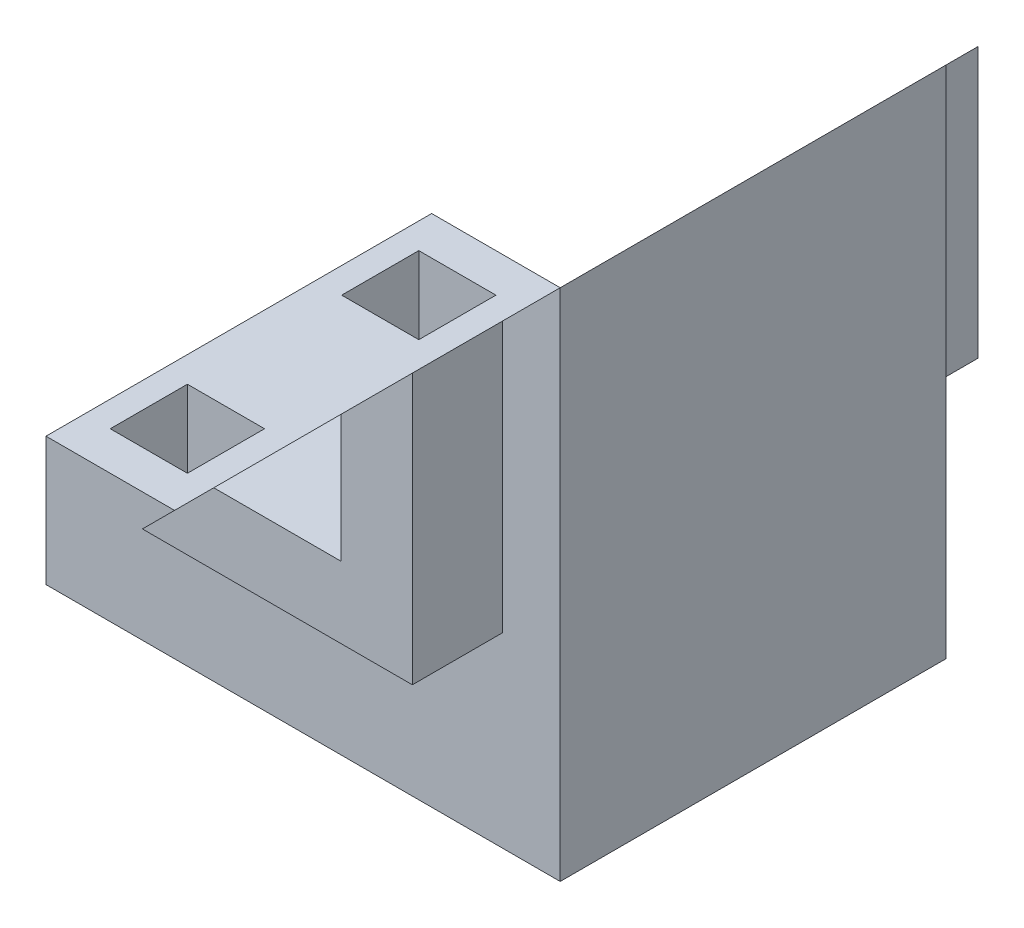
from build123d import *

# Parameters (mm, degrees)
EXTRUDE_3_DEPTH      = 15
EXTRUDE_3_DEPTH_BACK = 15
EXTRUDE_4_DEPTH      = 22
EXTRUDE_4_DEPTH_BACK = 22
SKETCH_2_W           = 6
SKETCH_2_H           = 6
CUT_EXTRUDE_2_DEPTH  = 43.237424164


with BuildPart() as part:
    # Эскиз1 → Бобышка-Вытянуть3 (new, two sides: drawn at the far end of the back side and taken through both)
    with BuildSketch(Plane.XY.offset(-EXTRUDE_3_DEPTH_BACK)):
        Polygon((-10, -10), (-20, -10), (-20, -20), (20, -20), (20, 20), (15.5, 15.5), (15.5, -5.5), (-5.5, -5.5), align=None)
    extrude(amount=EXTRUDE_3_DEPTH + EXTRUDE_3_DEPTH_BACK)

    # Эскиз1<6> → Бобышка-Вытянуть4 (add, two sides: drawn at the far end of the back side and taken through both)
    with BuildSketch(Plane.XY.offset(-EXTRUDE_4_DEPTH_BACK)):
        Polygon((0.050252532, 0.050252532), (-5.5, -5.5), (15.5, -5.5), (15.5, 15.5), (9.949747468, 9.949747468), (9.949747468, 0.050252532), align=None)
    extrude(amount=EXTRUDE_4_DEPTH + EXTRUDE_4_DEPTH_BACK)

    # Эскиз2 → Вырез-Вытянуть2 (cut, through all)
    with BuildSketch(Plane(origin=(0, -10, 0), x_dir=(1, 0, 0), z_dir=(0, 1, 0))):
        with Locations((-15, -9)):
            Rectangle(SKETCH_2_W, SKETCH_2_H)
    cut_extrude_2 = extrude(amount=-CUT_EXTRUDE_2_DEPTH, mode=Mode.SUBTRACT)

    # Зеркальное отражение1: Вырез-Вытянуть2 across plane
    add(cut_extrude_2.mirror(Plane.XY), mode=Mode.SUBTRACT)


solid = part.part
